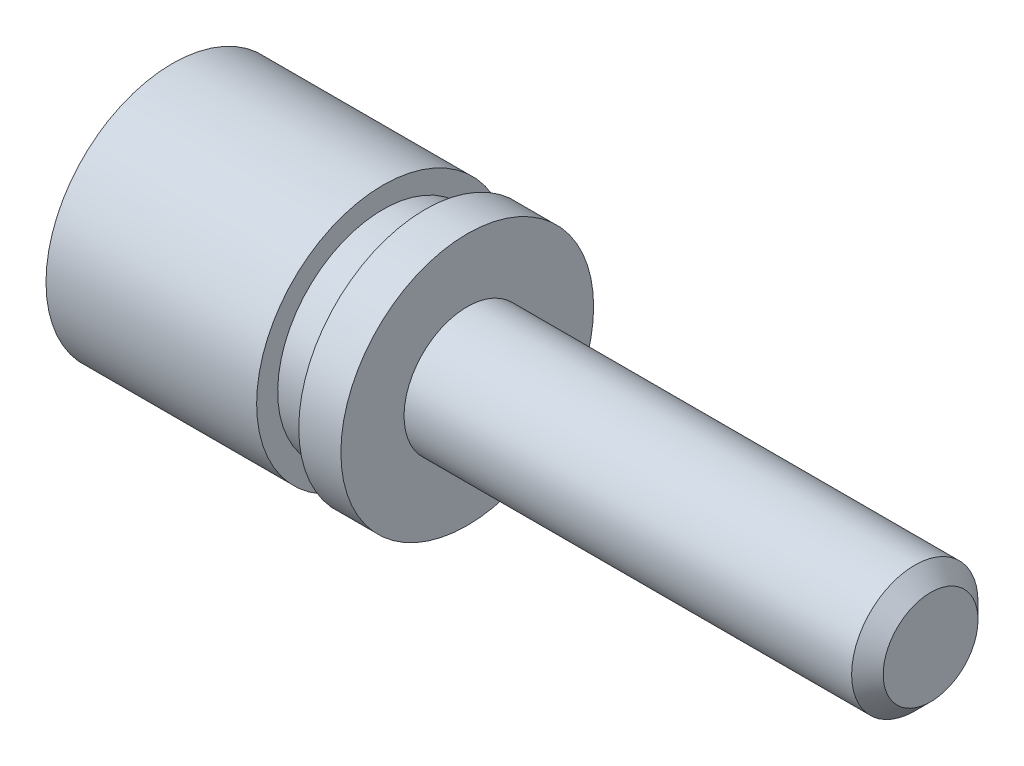
from build123d import *

# Parameters (mm, degrees)
CHANFREIN1_SIZE = 0.75


with BuildPart() as part:
    # Esquisse1 → Base-Révolution (revolve)
    with BuildSketch(Plane.XY, mode=Mode.PRIVATE) as base_r_volution_sk:
        with BuildLine():
            Line((0, 6), (10, 6))
            Line((10, 6), (10, 5))
            Line((10, 5), (12, 5))
            Line((12, 5), (12, 6))
            Line((12, 6), (14, 6))
            Line((14, 6), (14, 3))
            Line((14, 3), (36, 3))
            Line((36, 3), (36, 0))
            Line((36, 0), (-1.66190379, 0))
            ThreePointArc((-1.66190379, 0), (-1.238750773, 3.11295375), (0, 6))
        make_face()
    revolve(base_r_volution_sk.sketch.rotate(Axis((-3, 0, 0), (1, 0, 0)), 180), axis=Axis((-3, 0, 0), (1, 0, 0)))

    # Chanfrein1
    chanfrein1_edges = [part.edges().sort_by_distance(p)[0] for p in [
        (36, 3, 0),
    ]]
    chamfer(chanfrein1_edges, length=CHANFREIN1_SIZE)


solid = part.part
